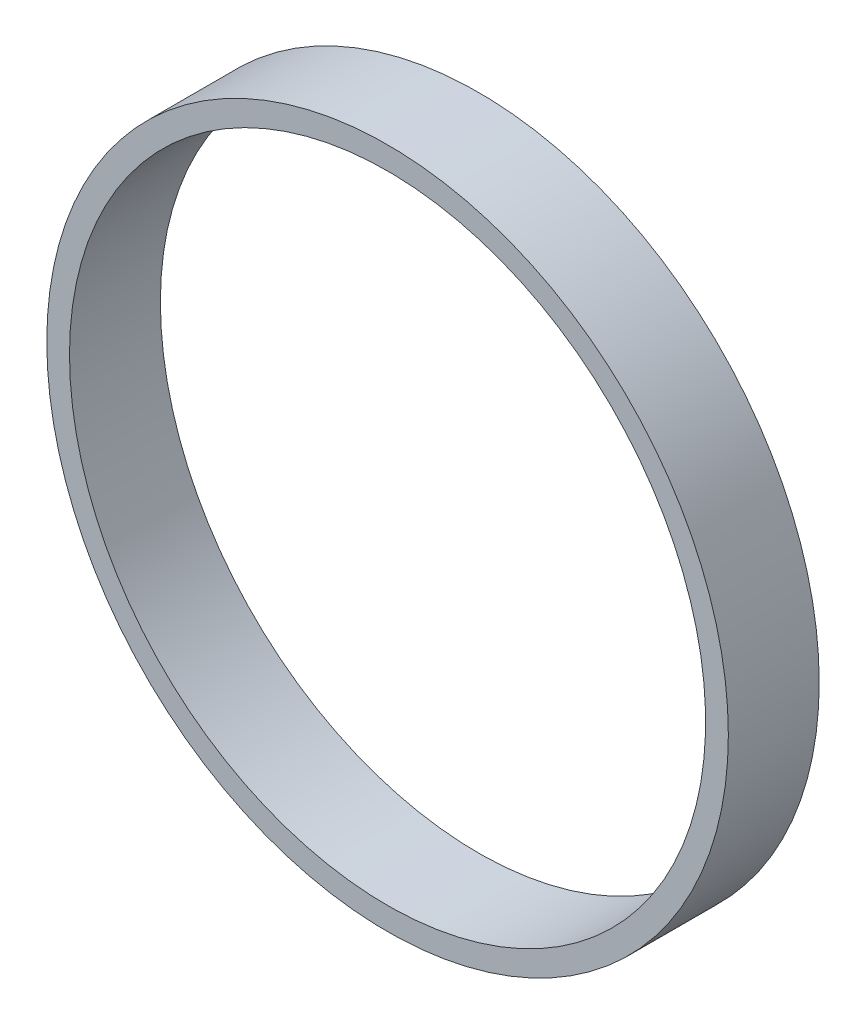
from build123d import *

# Parameters (mm, degrees)
SKETCH_1_W = 1.5
SKETCH_1_H = 6


with BuildPart() as part:
    # 草图1 → 旋转1 (revolve)
    with BuildSketch(Plane.XZ, mode=Mode.PRIVATE) as revolve_1_sk:
        with Locations((21.75, 3)):
            Rectangle(SKETCH_1_W, SKETCH_1_H)
    revolve(revolve_1_sk.sketch.rotate(Axis((0, 0, 6), (0, 0, -1)), 180), axis=Axis((0, 0, 6), (0, 0, -1)))


solid = part.part
